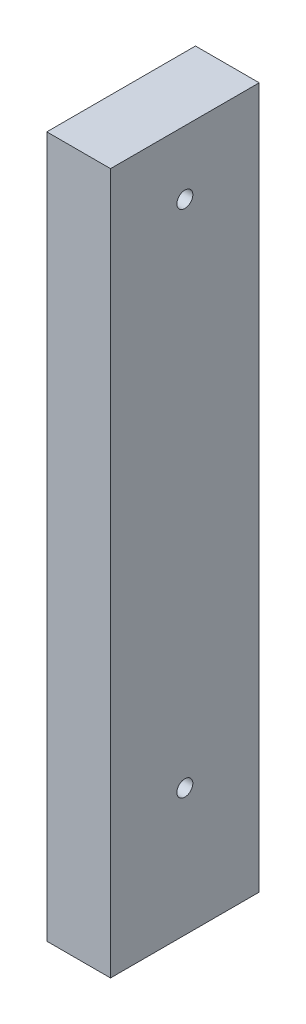
from build123d import *

# Parameters (mm, degrees)
SKETCH1_W           = 38.1
SKETCH1_H           = 88.9
BOSS_EXTRUDE1_DEPTH = 419.1
SKETCH2_OUTSIDE_W   = 176.924
SKETCH2_OUTSIDE_H   = 507.124
SKETCH2_OUTSIDE_W_2 = 88.9
SKETCH2_OUTSIDE_H_2 = 419.1
SKETCH2_OUTSIDE_R   = 4.7625
CUT_EXTRUDE1_DEPTH  = 38.1


with BuildPart() as part:
    # Sketch1 → Boss-Extrude1 (new body)
    with BuildSketch(Plane(origin=(0, 0, 0), x_dir=(1, 0, 0), z_dir=(0, 1, 0))):
        with Locations((19.05, 44.45)):
            Rectangle(SKETCH1_W, SKETCH1_H)
    extrude(amount=BOSS_EXTRUDE1_DEPTH)

    # Sketch2 outside → Cut-Extrude1 (cut)
    # profile 1 of 3: a face of its own
    with BuildSketch(Plane.ZY):
        with Locations((-44.45, 209.55)):
            Rectangle(SKETCH2_OUTSIDE_W, SKETCH2_OUTSIDE_H)
        with Locations((-44.45, 209.55)):
            Rectangle(SKETCH2_OUTSIDE_W_2, SKETCH2_OUTSIDE_H_2, mode=Mode.SUBTRACT)
    # profile 2 of 3: a face of its own
    with BuildSketch(Plane.ZY):
        with Locations((-44.45, 381)):
            Circle(SKETCH2_OUTSIDE_R)
    # profile 3 of 3: a face of its own
    with BuildSketch(Plane.ZY):
        with Locations((-44.45, 76.2)):
            Circle(SKETCH2_OUTSIDE_R)
    extrude(amount=-CUT_EXTRUDE1_DEPTH, mode=Mode.SUBTRACT)


solid = part.part
